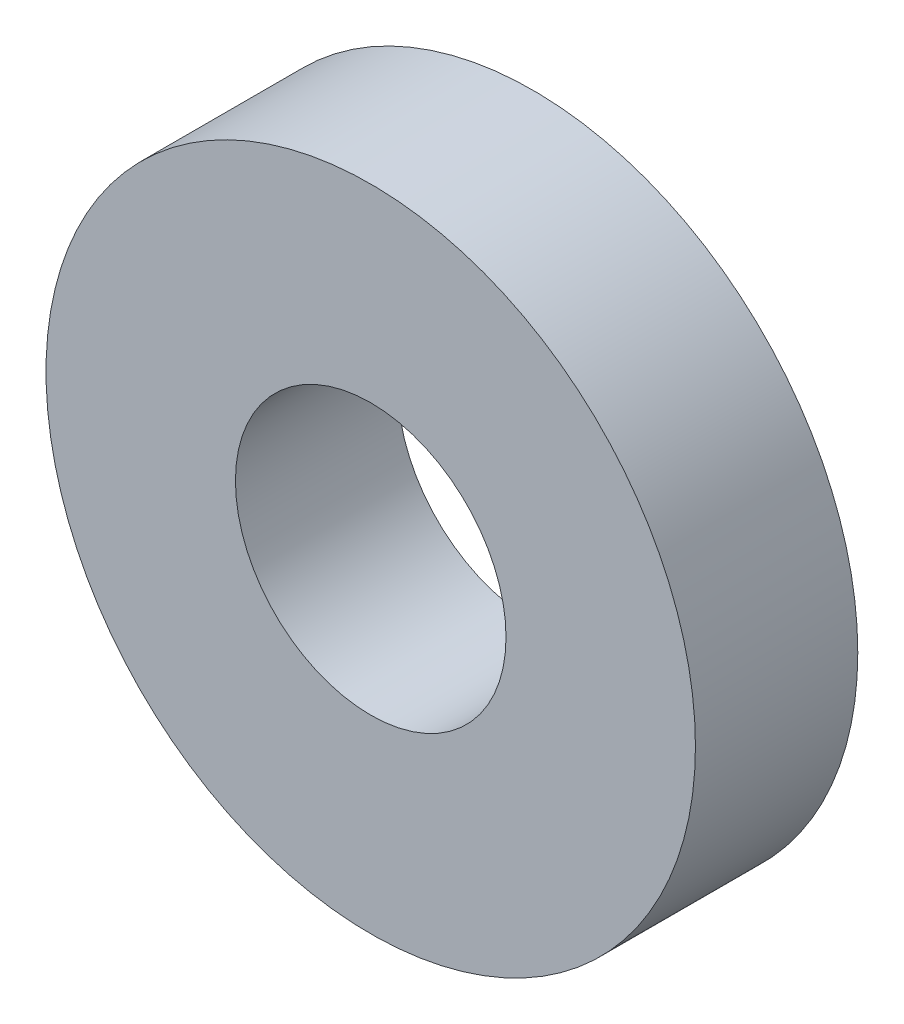
from build123d import *

# Parameters (mm, degrees)
SKETCH_1_R      = 12
SKETCH_1_R_2    = 5
EXTRUDE_1_DEPTH = 6


with BuildPart() as part:
    # 草图1 → 凸台-拉伸1 (new body)
    with BuildSketch(Plane.XY):
        Circle(SKETCH_1_R)
        Circle(SKETCH_1_R_2, mode=Mode.SUBTRACT)
    extrude(amount=EXTRUDE_1_DEPTH)


solid = part.part
